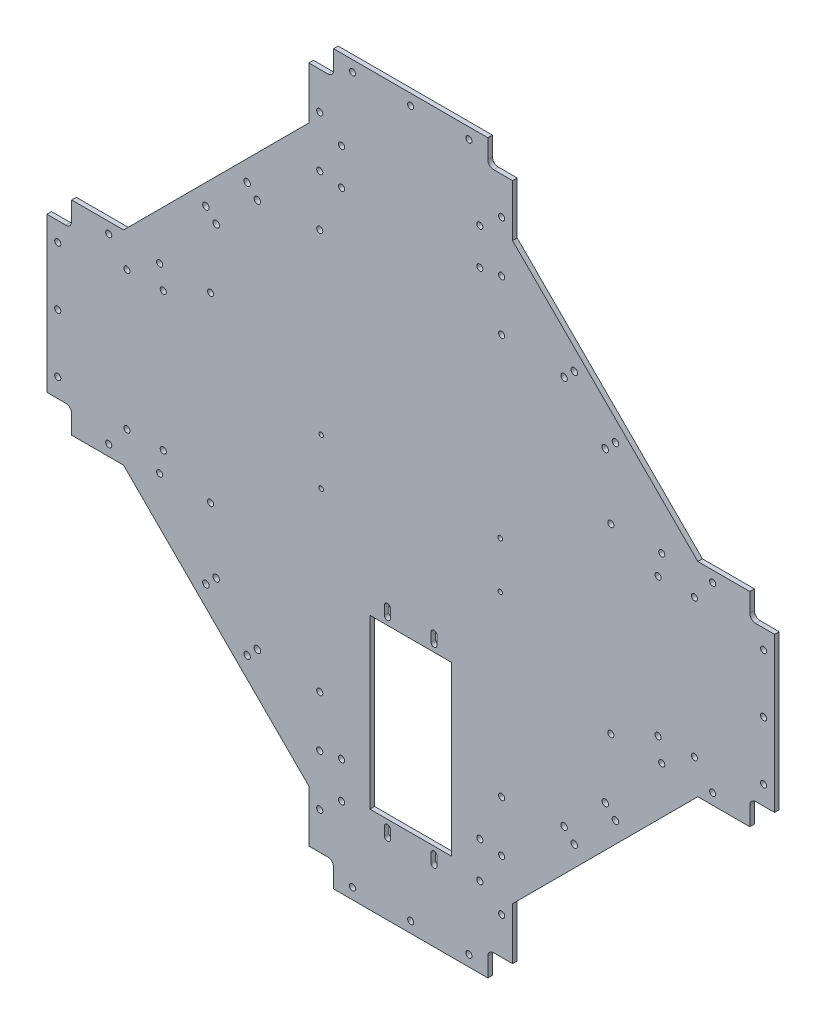
from build123d import *

# Parameters (mm, degrees)
SKETCH1_R           = 2.1
SKETCH1_W           = 56
SKETCH1_H           = 115.35
SKETCH1_R_2         = 1.55
BOSS_EXTRUDE1_DEPTH = 3.175
FILLET1_R           = 4
SKETCH10_R          = 2.25
BOSS_EXTRUDE2_DEPTH = 3.175
CIRPATTERN4_COUNT   = 4


with BuildPart() as part:
    # Sketch1 → Boss-Extrude1 (new body)
    with BuildSketch(Plane.XY):
        Polygon((0, 163), (0, 0), (-163, 0), (-163, -17), (-180, -17), (-180, -123), (-163, -123), (-163, -140), (0, -140), (0, -303), (17, -303), (17, -320), (123, -320), (123, -303), (140, -303), (140, -140), (303, -140), (303, -123), (320, -123), (320, -17), (303, -17), (303, 0), (140, 0), (140, 163), (123, 163), (123, 180), (17, 180), (17, 163), align=None)
        with Locations((7.5, -277.5)):
            Circle(SKETCH1_R, mode=Mode.SUBTRACT)
        with Locations((30, -312.5)):
            Circle(SKETCH1_R, mode=Mode.SUBTRACT)
        with Locations((70, -312.5)):
            Circle(SKETCH1_R, mode=Mode.SUBTRACT)
        with Locations((22.5, -265)):
            Circle(SKETCH1_R, mode=Mode.SUBTRACT)
        with BuildLine():
            Line((51.95, -271), (51.95, -265))
            ThreePointArc((51.95, -265), (54, -262.95), (56.05, -265))
            Line((56.05, -265), (56.05, -271))
            ThreePointArc((56.05, -271), (54, -273.05), (51.95, -271))
        make_face(mode=Mode.SUBTRACT)
        with Locations((7.5, -242.5)):
            Circle(SKETCH1_R, mode=Mode.SUBTRACT)
        with Locations((7.5, -207.5)):
            Circle(SKETCH1_R, mode=Mode.SUBTRACT)
        with Locations((22.5, -240)):
            Circle(SKETCH1_R, mode=Mode.SUBTRACT)
        with Locations((70, -202.325)):
            Rectangle(SKETCH1_W, SKETCH1_H, mode=Mode.SUBTRACT)
        with Locations((-172.5, -110)):
            Circle(SKETCH1_R, mode=Mode.SUBTRACT)
        with Locations((-137.5, -132.5)):
            Circle(SKETCH1_R, mode=Mode.SUBTRACT)
        with Locations((-125, -117.5)):
            Circle(SKETCH1_R, mode=Mode.SUBTRACT)
        with Locations((-102.5, -132.5)):
            Circle(SKETCH1_R, mode=Mode.SUBTRACT)
        with Locations((-100, -117.5)):
            Circle(SKETCH1_R, mode=Mode.SUBTRACT)
        with Locations((-67.5, -132.5)):
            Circle(SKETCH1_R, mode=Mode.SUBTRACT)
        with BuildLine():
            ThreePointArc((56.05, -139.65), (54, -141.7), (51.95, -139.65))
            Line((51.95, -139.65), (51.95, -133.65))
            ThreePointArc((51.95, -133.65), (54, -131.6), (56.05, -133.65))
            Line((56.05, -133.65), (56.05, -139.65))
        make_face(mode=Mode.SUBTRACT)
        with Locations((8.5, -86)):
            Circle(SKETCH1_R_2, mode=Mode.SUBTRACT)
        with Locations((110, -312.5)):
            Circle(SKETCH1_R, mode=Mode.SUBTRACT)
        with BuildLine():
            ThreePointArc((83.95, -265), (86, -262.95), (88.05, -265))
            Line((88.05, -265), (88.05, -271))
            ThreePointArc((88.05, -271), (86, -273.05), (83.95, -271))
            Line((83.95, -271), (83.95, -265))
        make_face(mode=Mode.SUBTRACT)
        with Locations((132.5, -277.5)):
            Circle(SKETCH1_R, mode=Mode.SUBTRACT)
        with Locations((117.5, -265)):
            Circle(SKETCH1_R, mode=Mode.SUBTRACT)
        with Locations((132.5, -242.5)):
            Circle(SKETCH1_R, mode=Mode.SUBTRACT)
        with Locations((117.5, -240)):
            Circle(SKETCH1_R, mode=Mode.SUBTRACT)
        with Locations((132.5, -207.5)):
            Circle(SKETCH1_R, mode=Mode.SUBTRACT)
        with BuildLine():
            Line((88.05, -133.65), (88.05, -139.65))
            ThreePointArc((88.05, -139.65), (86, -141.7), (83.95, -139.65))
            Line((83.95, -139.65), (83.95, -133.65))
            ThreePointArc((83.95, -133.65), (86, -131.6), (88.05, -133.65))
        make_face(mode=Mode.SUBTRACT)
        with Locations((131.5, -86)):
            Circle(SKETCH1_R_2, mode=Mode.SUBTRACT)
        with Locations((207.5, -132.5)):
            Circle(SKETCH1_R, mode=Mode.SUBTRACT)
        with Locations((242.5, -132.5)):
            Circle(SKETCH1_R, mode=Mode.SUBTRACT)
        with Locations((277.5, -132.5)):
            Circle(SKETCH1_R, mode=Mode.SUBTRACT)
        with Locations((240, -117.5)):
            Circle(SKETCH1_R, mode=Mode.SUBTRACT)
        with Locations((265, -117.5)):
            Circle(SKETCH1_R, mode=Mode.SUBTRACT)
        with Locations((312.5, -110)):
            Circle(SKETCH1_R, mode=Mode.SUBTRACT)
        with Locations((312.5, -70)):
            Circle(SKETCH1_R, mode=Mode.SUBTRACT)
        with Locations((-172.5, -70)):
            Circle(SKETCH1_R, mode=Mode.SUBTRACT)
        with Locations((-172.5, -30)):
            Circle(SKETCH1_R, mode=Mode.SUBTRACT)
        with Locations((-125, -22.5)):
            Circle(SKETCH1_R, mode=Mode.SUBTRACT)
        with Locations((-100, -22.5)):
            Circle(SKETCH1_R, mode=Mode.SUBTRACT)
        with Locations((-137.5, -7.5)):
            Circle(SKETCH1_R, mode=Mode.SUBTRACT)
        with Locations((-102.5, -7.5)):
            Circle(SKETCH1_R, mode=Mode.SUBTRACT)
        with Locations((-67.5, -7.5)):
            Circle(SKETCH1_R, mode=Mode.SUBTRACT)
        with Locations((8.5, -54)):
            Circle(SKETCH1_R_2, mode=Mode.SUBTRACT)
        with Locations((7.5, 67.5)):
            Circle(SKETCH1_R, mode=Mode.SUBTRACT)
        with Locations((7.5, 102.5)):
            Circle(SKETCH1_R, mode=Mode.SUBTRACT)
        with Locations((22.5, 100)):
            Circle(SKETCH1_R, mode=Mode.SUBTRACT)
        with Locations((7.5, 137.5)):
            Circle(SKETCH1_R, mode=Mode.SUBTRACT)
        with Locations((22.5, 125)):
            Circle(SKETCH1_R, mode=Mode.SUBTRACT)
        with Locations((30, 172.5)):
            Circle(SKETCH1_R, mode=Mode.SUBTRACT)
        with Locations((70, 172.5)):
            Circle(SKETCH1_R, mode=Mode.SUBTRACT)
        with Locations((131.5, -54)):
            Circle(SKETCH1_R_2, mode=Mode.SUBTRACT)
        with Locations((207.5, -7.5)):
            Circle(SKETCH1_R, mode=Mode.SUBTRACT)
        with Locations((240, -22.5)):
            Circle(SKETCH1_R, mode=Mode.SUBTRACT)
        with Locations((242.5, -7.5)):
            Circle(SKETCH1_R, mode=Mode.SUBTRACT)
        with Locations((265, -22.5)):
            Circle(SKETCH1_R, mode=Mode.SUBTRACT)
        with Locations((277.5, -7.5)):
            Circle(SKETCH1_R, mode=Mode.SUBTRACT)
        with Locations((312.5, -30)):
            Circle(SKETCH1_R, mode=Mode.SUBTRACT)
        with Locations((132.5, 67.5)):
            Circle(SKETCH1_R, mode=Mode.SUBTRACT)
        with Locations((117.5, 100)):
            Circle(SKETCH1_R, mode=Mode.SUBTRACT)
        with Locations((132.5, 102.5)):
            Circle(SKETCH1_R, mode=Mode.SUBTRACT)
        with Locations((117.5, 125)):
            Circle(SKETCH1_R, mode=Mode.SUBTRACT)
        with Locations((132.5, 137.5)):
            Circle(SKETCH1_R, mode=Mode.SUBTRACT)
        with Locations((110, 172.5)):
            Circle(SKETCH1_R, mode=Mode.SUBTRACT)
    extrude(amount=BOSS_EXTRUDE1_DEPTH)

    # Fillet1
    fillet1_edges = [part.edges().sort_by_distance(p)[0] for p in [
        (17, 163, 1.5875),
        (0, 0, 1.5875),
        (-163, -17, 1.5875),
        (-163, -123, 1.5875),
        (0, -140, 1.5875),
        (17, -303, 1.5875),
        (123, -303, 1.5875),
        (140, -140, 1.5875),
        (303, -123, 1.5875),
        (303, -17, 1.5875),
        (140, 0, 1.5875),
        (123, 163, 1.5875),
    ]]
    fillet(fillet1_edges, radius=FILLET1_R)

    # Sketch10 → Boss-Extrude2 (add)
    with BuildSketch(Plane.XY):
        Polygon((-127.279220614, -140), (0, -267.279220614), (0, -140), align=None)
        with Locations((-70.710678119, -182.426406871)):
            Circle(SKETCH10_R, mode=Mode.SUBTRACT)
        with Locations((-42.426406871, -210.710678119)):
            Circle(SKETCH10_R, mode=Mode.SUBTRACT)
        with Locations((-63.639610307, -175.355339059)):
            Circle(SKETCH10_R, mode=Mode.SUBTRACT)
        with Locations((-35.355339059, -203.639610307)):
            Circle(SKETCH10_R, mode=Mode.SUBTRACT)
    boss_extrude2 = extrude(amount=BOSS_EXTRUDE2_DEPTH)

    # CirPattern4: Boss-Extrude2 ×4 about axis
    cirpattern4_axis = Axis((70, -70, 0), (0, 0, 1))
    for i in range(1, CIRPATTERN4_COUNT):
        add(boss_extrude2.rotate(cirpattern4_axis, i * 360 / CIRPATTERN4_COUNT))


solid = part.part
